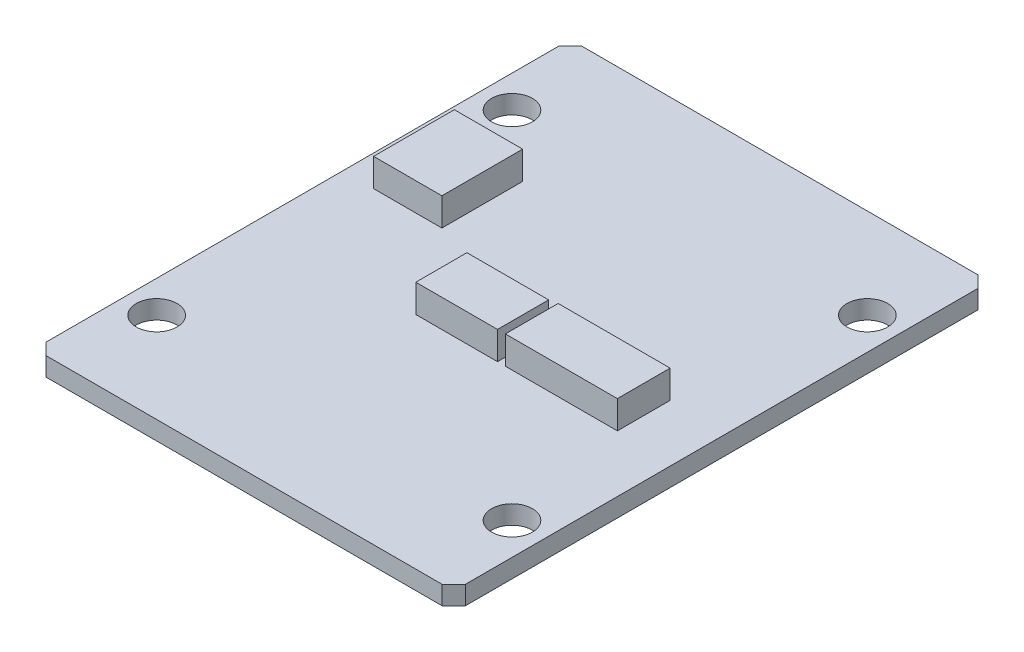
from build123d import *

# Parameters (mm, degrees)
SKETCH1_W        = 36
SKETCH1_H        = 5
SKETCH1_H_2      = 36
SKETCH1_R        = 1.75
PCB_DEPTH        = 1.6
SKETCH2_W        = 5.863870515
SKETCH2_H        = 6.933382723
SKETCH2_W_2      = 7.016073618
SKETCH2_H_2      = 4.389541424
SKETCH2_W_3      = 9.613875512
SKETCH2_H_3      = 4.530712508
COMPONENTS_DEPTH = 2.4
CORNERS_SIZE     = 1


with BuildPart() as part:
    # Sketch1 → PCB (new body)
    # profile 1 of 3: a face of its own
    with BuildSketch(Plane(origin=(0, 0, 0), x_dir=(1, 0, 0), z_dir=(0, 1, 0))):
        with Locations((0, 20.5)):
            Rectangle(SKETCH1_W, SKETCH1_H)
    # profile 2 of 3: a face of its own
    with BuildSketch(Plane(origin=(0, 0, 0), x_dir=(1, 0, 0), z_dir=(0, 1, 0))):
        Rectangle(SKETCH1_W, SKETCH1_H_2)
        with Locations(Location((-15.25, -15.25, 0), (0, 0, 270))):
            Circle(SKETCH1_R, mode=Mode.SUBTRACT)
        with Locations(Location((15.25, -15.25, 0), (0, 0, 270))):
            Circle(SKETCH1_R, mode=Mode.SUBTRACT)
        with Locations(Location((-15.25, 15.25, 0), (0, 0, 270))):
            Circle(SKETCH1_R, mode=Mode.SUBTRACT)
        with Locations(Location((15.25, 15.25, 0), (0, 0, 270))):
            Circle(SKETCH1_R, mode=Mode.SUBTRACT)
    # profile 3 of 3: a face of its own
    with BuildSketch(Plane(origin=(0, 0, 0), x_dir=(1, 0, 0), z_dir=(0, 1, 0))):
        with Locations((0, -20.5)):
            Rectangle(SKETCH1_W, SKETCH1_H)
    extrude(amount=PCB_DEPTH)

    # Sketch2 → Components (add)
    with BuildSketch(Plane(origin=(0, 1.6, 0), x_dir=(1, 0, 0), z_dir=(0, 1, 0))):
        with Locations((-12.422852881, 6.938659117)):
            Rectangle(SKETCH2_W, SKETCH2_H)
        with Locations((-0.676707896, -1.879325534)):
            Rectangle(SKETCH2_W_2, SKETCH2_H_2)
        with Locations((8.311019041, -1.808739992)):
            Rectangle(SKETCH2_W_3, SKETCH2_H_3)
    extrude(amount=COMPONENTS_DEPTH)

    # Corners
    corners_edges = [part.edges().sort_by_distance(p)[0] for p in [
        (-18, 0.8, -23),
        (18, 0.8, -23),
        (18, 0.8, 23),
        (-18, 0.8, 23),
    ]]
    chamfer(corners_edges, length=CORNERS_SIZE)


solid = part.part
